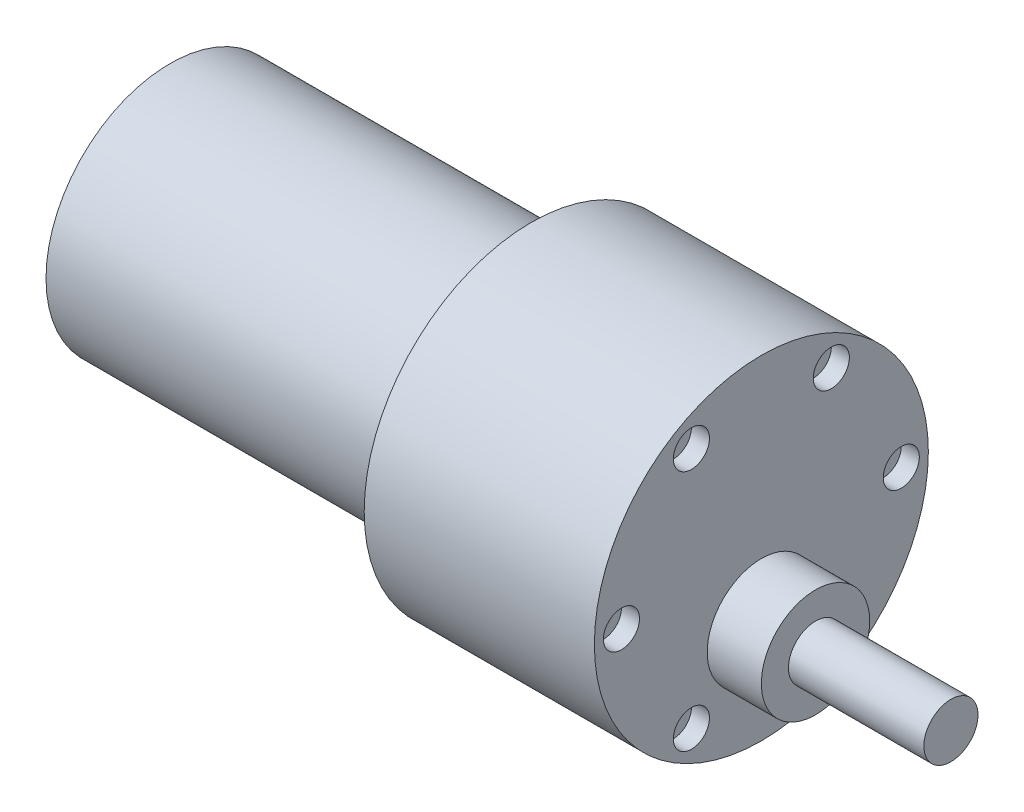
from build123d import *

# Parameters (mm, degrees)
SKETCH1_R           = 18.5
BOSS_EXTRUDE1_DEPTH = 25.5
SKETCH2_R           = 13.75
BOSS_EXTRUDE2_DEPTH = 40
SKETCH3_R           = 6
BOSS_EXTRUDE3_DEPTH = 6
SKETCH4_R           = 3
BOSS_EXTRUDE4_DEPTH = 15
SKETCH5_R           = 2
CUT_EXTRUDE1_DEPTH  = 2


with BuildPart() as part:
    # Sketch1 → Boss-Extrude1 (new body)
    with BuildSketch(Plane(origin=(0, 0, 0), x_dir=(0, 0, -1), z_dir=(1, 0, 0))):
        Circle(SKETCH1_R)
    extrude(amount=-BOSS_EXTRUDE1_DEPTH)

    # Sketch2 → Boss-Extrude2 (add)
    with BuildSketch(Plane.ZY.offset(25.5)):
        Circle(SKETCH2_R)
    extrude(amount=BOSS_EXTRUDE2_DEPTH)

    # Sketch3 → Boss-Extrude3 (add)
    with BuildSketch(Plane(origin=(0, 0, 0), x_dir=(0, 0, -1), z_dir=(1, 0, 0))):
        with Locations((0, -7)):
            Circle(SKETCH3_R)
    extrude(amount=BOSS_EXTRUDE3_DEPTH)

    # Sketch4 → Boss-Extrude4 (add)
    with BuildSketch(Plane(origin=(6, 0, 0), x_dir=(0, 0, -1), z_dir=(1, 0, 0))):
        with Locations((0, -7)):
            Circle(SKETCH4_R)
    extrude(amount=BOSS_EXTRUDE4_DEPTH)

    # Sketch5 → Cut-Extrude1 (cut)
    with BuildSketch(Plane(origin=(0, 0, 0), x_dir=(0, 0, -1), z_dir=(1, 0, 0))):
        with Locations((-15.5, 0)):
            Circle(SKETCH5_R)
        with Locations((-7.75, 13.423393759)):
            Circle(SKETCH5_R)
        with Locations((7.75, 13.423393759)):
            Circle(SKETCH5_R)
        with Locations((15.5, 0)):
            Circle(SKETCH5_R)
        with Locations((7.75, -13.423393759)):
            Circle(SKETCH5_R)
        with Locations((-7.75, -13.423393759)):
            Circle(SKETCH5_R)
    extrude(amount=-CUT_EXTRUDE1_DEPTH, mode=Mode.SUBTRACT)


solid = part.part
